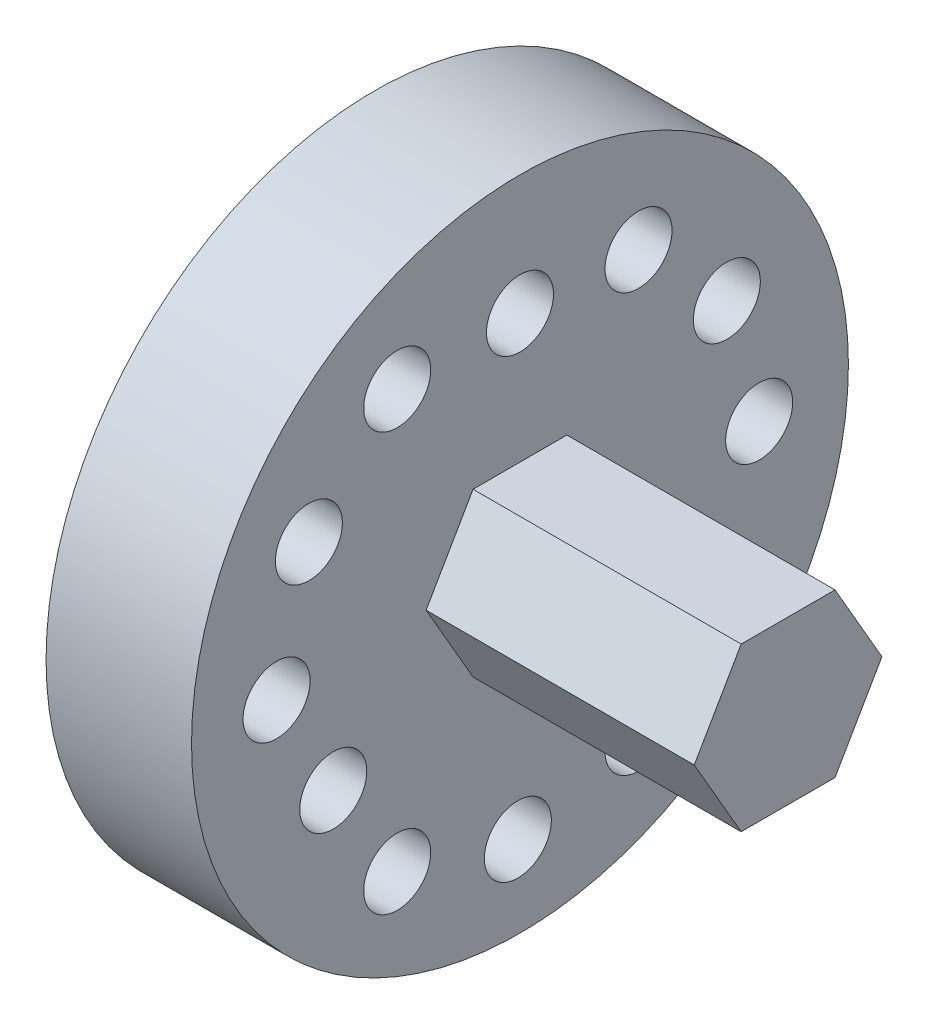
from build123d import *

# Parameters (mm, degrees)
SKETCH1_R           = 24.5
SKETCH1_R_2         = 2.5
BOSS_EXTRUDE1_DEPTH = 10.85
BOSS_EXTRUDE2_DEPTH = 20


with BuildPart() as part:
    # Sketch1 → Boss-Extrude1 (new body)
    with BuildSketch(Plane(origin=(0, 0, 0), x_dir=(0, 0, -1), z_dir=(1, 0, 0))):
        Circle(SKETCH1_R)
        with Locations((0, 15.545215773)):
            Circle(SKETCH1_R_2, mode=Mode.SUBTRACT)
        with Locations((13.612452271, -8.304784227)):
            Circle(SKETCH1_R_2, mode=Mode.SUBTRACT)
        with Locations((-13.927155569, -8.304784227)):
            Circle(SKETCH1_R_2, mode=Mode.SUBTRACT)
        with Locations((8.842648351, 15.233673041)):
            Circle(SKETCH1_R_2, mode=Mode.SUBTRACT)
        with Locations((15.431105619, 8.645215773)):
            Circle(SKETCH1_R_2, mode=Mode.SUBTRACT)
        with Locations((17.842648351, -0.354784227)):
            Circle(SKETCH1_R_2, mode=Mode.SUBTRACT)
        with Locations((8.842648351, -15.943241495)):
            Circle(SKETCH1_R_2, mode=Mode.SUBTRACT)
        with Locations((-0.157351649, -18.354784227)):
            Circle(SKETCH1_R_2, mode=Mode.SUBTRACT)
        with Locations((-9.157351649, -15.943241495)):
            Circle(SKETCH1_R_2, mode=Mode.SUBTRACT)
        with Locations((-18.157351649, -0.354784227)):
            Circle(SKETCH1_R_2, mode=Mode.SUBTRACT)
        with Locations((-15.745808917, 8.645215773)):
            Circle(SKETCH1_R_2, mode=Mode.SUBTRACT)
        with Locations((-9.157351649, 15.233673041)):
            Circle(SKETCH1_R_2, mode=Mode.SUBTRACT)
    extrude(amount=BOSS_EXTRUDE1_DEPTH)

    # Sketch4 → Boss-Extrude2 (add)
    with BuildSketch(Plane(origin=(10.85, 0, 0), x_dir=(0, 0, -1), z_dir=(1, 0, 0))):
        Polygon((7, -0.130869058), (3.5, 5.931308769), (-3.5, 5.931308769), (-7, -0.130869058), (-3.5, -6.193046884), (3.5, -6.193046884), align=None)
    extrude(amount=BOSS_EXTRUDE2_DEPTH)


solid = part.part
